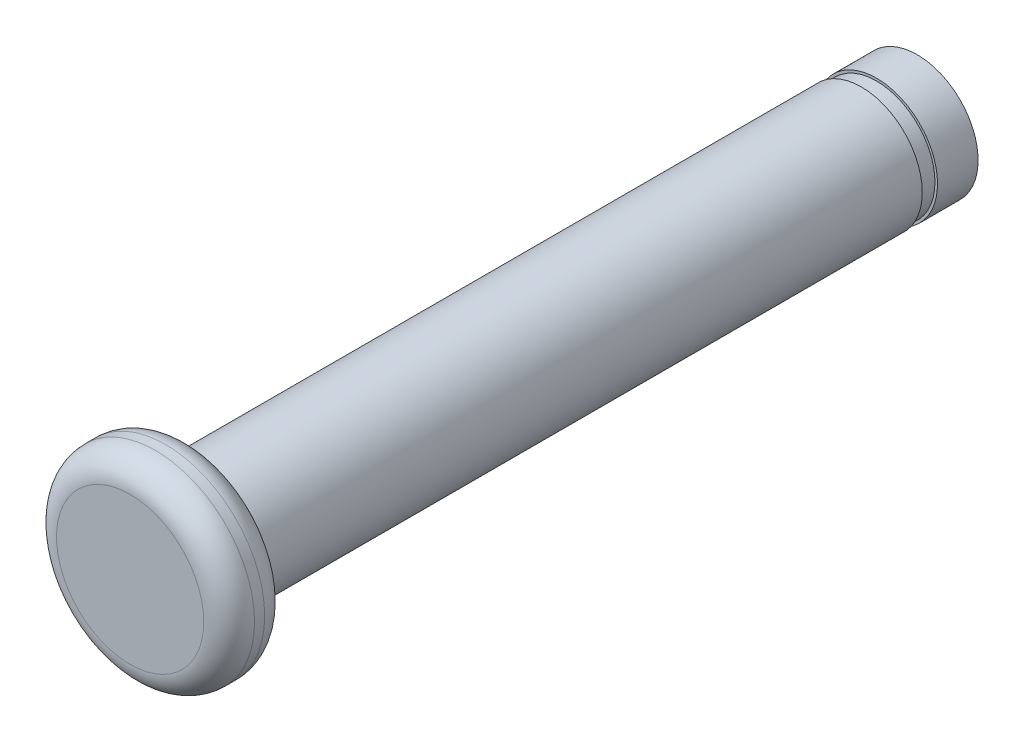
from build123d import *

# Parameters (mm, degrees)
SKETCH1_R           = 2.4765
BOSS_EXTRUDE1_DEPTH = 1.524
SKETCH2_R           = 1.524
BOSS_EXTRUDE2_DEPTH = 18.161
CUT_EXTRUDE1_START  = -1.397
SKETCH4_R           = 1.524
CUT_EXTRUDE1_DEPTH  = 1.397
SKETCH5_R           = 1.4605
BOSS_EXTRUDE3_DEPTH = 0.381
SKETCH6_R           = 1.524
BOSS_EXTRUDE4_DEPTH = 1.016
FILLET1_R           = 0.635


with BuildPart() as part:
    # Sketch1 → Boss-Extrude1 (new body)
    with BuildSketch(Plane.XY):
        Circle(SKETCH1_R)
    extrude(amount=-BOSS_EXTRUDE1_DEPTH)

    # Sketch2 → Boss-Extrude2 (add)
    with BuildSketch(Plane(origin=(0, 0, -1.524), x_dir=(-1, 0, 0), z_dir=(0, 0, -1))):
        with Locations(Location((0, 0, 0), (0, 0, 180))):
            Circle(SKETCH2_R)
    extrude(amount=BOSS_EXTRUDE2_DEPTH)

    # Sketch4 → Cut-Extrude1 (cut)
    with BuildSketch(Plane(origin=(0, 0, -19.685), x_dir=(-1, 0, 0), z_dir=(0, 0, -1)).offset(CUT_EXTRUDE1_START)):
        with Locations(Location((0, 0, 0), (0, 0, 180))):
            Circle(SKETCH4_R)
    extrude(amount=CUT_EXTRUDE1_DEPTH, mode=Mode.SUBTRACT)

    # Sketch5 → Boss-Extrude3 (add)
    with BuildSketch(Plane(origin=(0, 0, -18.288), x_dir=(-1, 0, 0), z_dir=(0, 0, -1))):
        with Locations(Location((0, 0, 0), (0, 0, 180))):
            Circle(SKETCH5_R)
    extrude(amount=BOSS_EXTRUDE3_DEPTH)

    # Sketch6 → Boss-Extrude4 (add)
    with BuildSketch(Plane(origin=(0, 0, -18.669), x_dir=(-1, 0, 0), z_dir=(0, 0, -1))):
        with Locations(Location((0, 0, 0), (0, 0, 180))):
            Circle(SKETCH6_R)
    extrude(amount=BOSS_EXTRUDE4_DEPTH)

    # Fillet1
    fillet1_edges = [part.edges().sort_by_distance(p)[0] for p in [
        (-2.4765, 0, 0),
        (-2.4765, 0, -1.524),
    ]]
    fillet(fillet1_edges, radius=FILLET1_R)


solid = part.part
